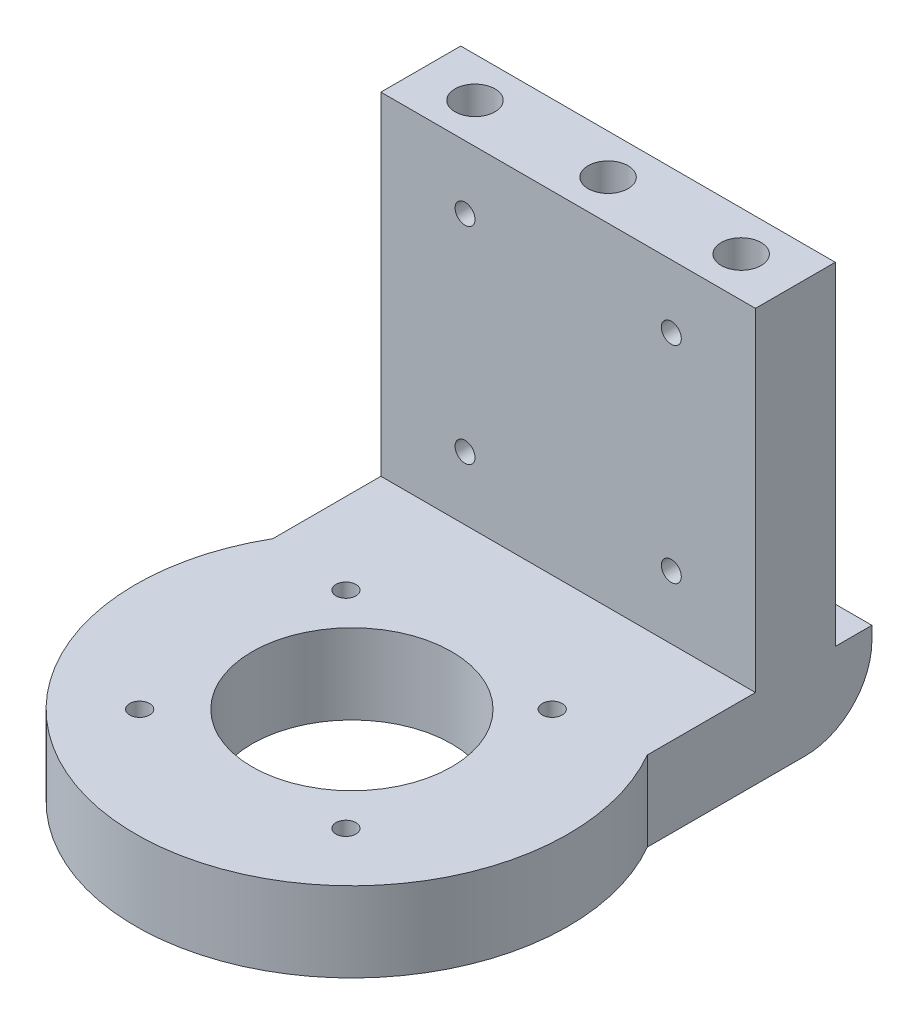
from build123d import *

# Parameters (mm, degrees)
SKETCH_1_R          = 32.5
SKETCH_1_R_2        = 15
EXTRUDE_1_DEPTH     = 12
SKETCH_2_R          = 1.5
CUT_EXTRUDE_1_DEPTH = 12
EXTRUDE_START       = -12
EXTRUDE_2_DEPTH     = 12
EXTRUDE_3_DEPTH     = 50
SKETCH_5_R          = 3
CUT_EXTRUDE_2_DEPTH = 5
SKETCH_6_R          = 3
CUT_EXTRUDE_3_DEPTH = 3
SKETCH_7_R          = 1.5
CUT_EXTRUDE_9_DEPTH = 105.063682426
FILLET_1_R          = 10


with BuildPart() as part:
    # 草图1 → 凸台-拉伸1 (new body)
    with BuildSketch(Plane(origin=(0, 0, 0), x_dir=(1, 0, 0), z_dir=(0, 1, 0))):
        with Locations(Location((0, 0, 0), (0, 0, 270))):
            Circle(SKETCH_1_R)
        with Locations(Location((0, 0, 0), (0, 0, 270))):
            Circle(SKETCH_1_R_2, mode=Mode.SUBTRACT)
    extrude(amount=EXTRUDE_1_DEPTH)

    # 草图2 → 切除-拉伸1 (cut)
    with BuildSketch(Plane(origin=(0, 12, 0), x_dir=(1, 0, 0), z_dir=(0, 1, 0))):
        with Locations(Location((-15.95, 15.05, 0), (0, 0, 270))):
            Circle(SKETCH_2_R)
        with Locations(Location((15.05, 15.05, 0), (0, 0, 270))):
            Circle(SKETCH_2_R)
        with Locations(Location((15.05, -15.95, 0), (0, 0, 270))):
            Circle(SKETCH_2_R)
        with Locations(Location((-15.95, -15.95, 0), (0, 0, 270))):
            Circle(SKETCH_2_R)
    extrude(amount=-CUT_EXTRUDE_1_DEPTH, mode=Mode.SUBTRACT)

    # 草图3 → 凸台-拉伸2 (add)
    with BuildSketch(Plane(origin=(0, 12, 0), x_dir=(1, 0, 0), z_dir=(0, 1, 0)).offset(EXTRUDE_START)):
        with BuildLine():
            Line((-28.145825623, 50), (-28.145825623, 16.25))
            ThreePointArc((-28.145825623, 16.25), (-16.25, 28.145825623), (0, 32.5))
            Line((0, 32.5), (0, 50))
            Line((0, 50), (-28.145825623, 50))
        make_face()
        with BuildLine():
            ThreePointArc((0, 32.5), (16.25, 28.145825623), (28.145825623, 16.25))
            Line((28.145825623, 16.25), (28.145825623, 50))
            Line((28.145825623, 50), (0, 50))
            Line((0, 50), (0, 32.5))
        make_face()
    extrude(amount=EXTRUDE_2_DEPTH)

    # 草图4 → 凸台-拉伸3 (add)
    with BuildSketch(Plane(origin=(0, 12, 0), x_dir=(1, 0, 0), z_dir=(0, 1, 0))):
        Polygon((28.145825623, 32.5), (28.145825623, 44.5), (-28.145825623, 44.5), (-28.145825623, 32.5), (0, 32.5), align=None)
    extrude(amount=EXTRUDE_3_DEPTH)

    # 草图5 → 切除-拉伸2 (cut)
    with BuildSketch(Plane(origin=(0, 62, 0), x_dir=(1, 0, 0), z_dir=(0, 1, 0))):
        with Locations(Location((0, 38.5, 0), (0, 0, 270))):
            Circle(SKETCH_5_R)
        with Locations(Location((20, 38.5, 0), (0, 0, 270))):
            Circle(SKETCH_5_R)
        with Locations(Location((-20, 38.5, 0), (0, 0, 270))):
            Circle(SKETCH_5_R)
    extrude(amount=-CUT_EXTRUDE_2_DEPTH, mode=Mode.SUBTRACT)

    # 草图6 → 切除-拉伸3 (cut)
    with BuildSketch(Plane.XZ):
        with Locations(Location((15.05, 15.95, 0), (0, 0, 270))):
            Circle(SKETCH_6_R)
        with Locations(Location((-15.95, 15.95, 0), (0, 0, 270))):
            Circle(SKETCH_6_R)
        with Locations(Location((-15.95, -15.05, 0), (0, 0, 270))):
            Circle(SKETCH_6_R)
        with Locations(Location((15.05, -15.05, 0), (0, 0, 270))):
            Circle(SKETCH_6_R)
    extrude(amount=-CUT_EXTRUDE_3_DEPTH, mode=Mode.SUBTRACT)

    # 草图7 → 切除-拉伸9 (cut, through all)
    with BuildSketch(Plane(origin=(0, 0, -44.5), x_dir=(-1, 0, 0), z_dir=(0, 0, -1))):
        with Locations((15.5, 52.5)):
            Circle(SKETCH_7_R)
        with Locations((15.5, 21.5)):
            Circle(SKETCH_7_R)
        with Locations((-15.5, 52.5)):
            Circle(SKETCH_7_R)
        with Locations((-15.5, 21.5)):
            Circle(SKETCH_7_R)
    extrude(amount=-CUT_EXTRUDE_9_DEPTH, mode=Mode.SUBTRACT)

    # 圆角1
    fillet_1_edges = [part.edges().sort_by_distance(p)[0] for p in [
        (0, 0, -50),
    ]]
    fillet(fillet_1_edges, radius=FILLET_1_R)


solid = part.part
